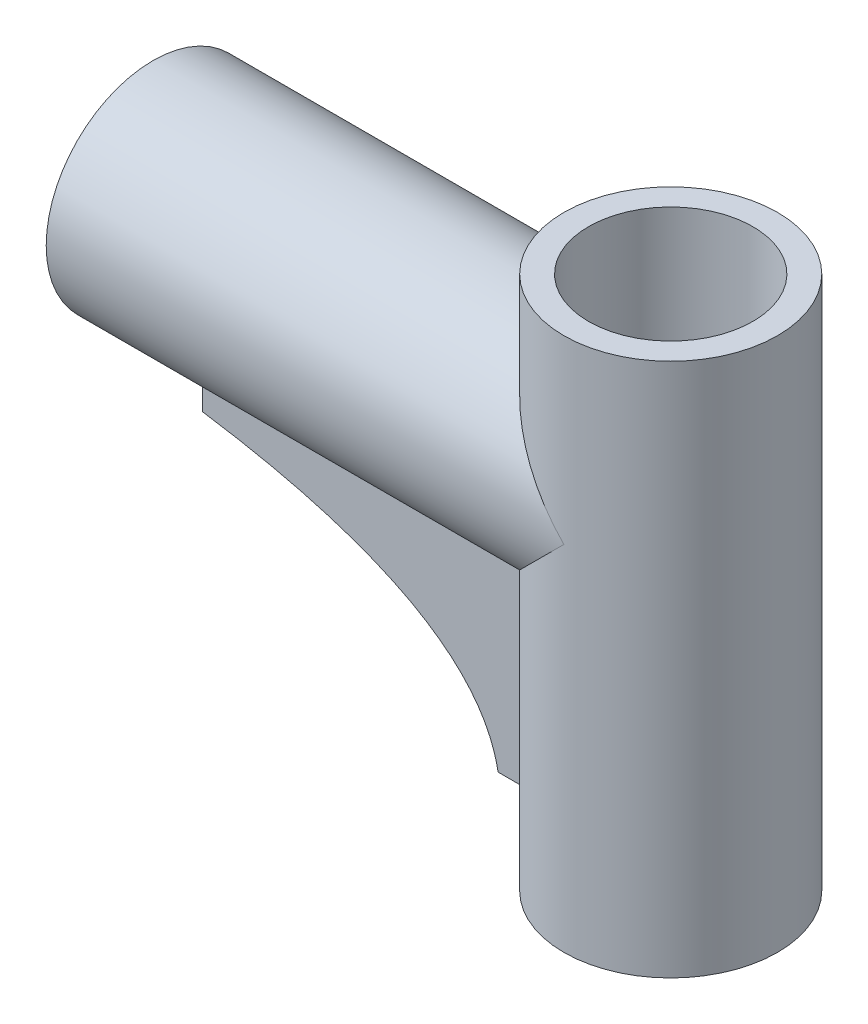
from build123d import *

# Parameters (mm, degrees)
BUITENCIRKEL_R                    = 13
CILINDER_BASIS_DEPTH              = 65
BINNENCIRKEL_MOTOR_R              = 11
HOLTE_MOTOR_DEPTH                 = 25
BINNENCIRKEL_BUIS_R               = 10
HOLTE_BUIS_DEPTH                  = 35
UITSPARING_MOTORAS_DEPTH          = 45.02272140611028
CIRKEL_MOTORPINNETJES_R           = 0.8999999999999995
UITSPARINGEN_MOTORPINNETJES_DEPTH = 2
CIRKEL_POLEN_R                    = 2.450000000000002
UITSPARINGEN_MOTORPOLEN_DEPTH     = 45.02272140611028
SKETCH2_R                         = 13.000000000000007
BOSS_EXTRUDE1_DEPTH               = 50
BOSS_EXTRUDE1_DIRECTION_2_REACH   = 73.204
SKETCH3_R                         = 10.000000000000005
CUT_EXTRUDE1_DEPTH                = 40
CUT_EXTRUDE2_REACH                = 79.421
CUT_EXTRUDE2_END_RADIUS           = 10
SKETCH4_R                         = 6.999999999999997
BOSS_EXTRUDE2_DEPTH               = 5
BOSS_EXTRUDE2_DEPTH_BACK          = 5
BOSS_EXTRUDE6_REACH               = 76.713
BOSS_EXTRUDE6_END_RADIUS          = 13.000000000000007
SKETCH11_W                        = 36.000000000000014
SKETCH11_H                        = 10
BOSS_EXTRUDE7_REACH               = 83.259
BOSS_EXTRUDE7_END_RADIUS          = 13.000000000000002
SKETCH12_W                        = 10
SKETCH12_H                        = 24.000000000000004


with BuildPart() as part:
    # Buitencirkel → Cilinder basis (new body)
    with BuildSketch(Plane(origin=(0, 0, 0), x_dir=(1, 0, 0), z_dir=(0, 1, 0))):
        Circle(BUITENCIRKEL_R)
    extrude(amount=CILINDER_BASIS_DEPTH)

    # Binnencirkel motor → Holte motor (cut)
    with BuildSketch(Plane(origin=(0, 0, 0), x_dir=(-1, 0, 0), z_dir=(0, -1, 0))):
        Circle(BINNENCIRKEL_MOTOR_R)
    extrude(amount=-HOLTE_MOTOR_DEPTH, mode=Mode.SUBTRACT)

    # Binnencirkel buis → Holte buis (cut)
    with BuildSketch(Plane(origin=(0, 65, 0), x_dir=(1, 0, 0), z_dir=(0, 1, 0))):
        Circle(BINNENCIRKEL_BUIS_R)
    extrude(amount=-HOLTE_BUIS_DEPTH, mode=Mode.SUBTRACT)

    # Cirkel motoras → Uitsparing motoras (cut, through all)
    with BuildSketch(Plane(origin=(0, 24.999999999999996, 0), x_dir=(-1, 0, 0), z_dir=(0, -1, 0))):
        with BuildLine():
            Line((2.3500000000000005, -1.6124515496597092), (2.3500000000000005, 1.6124515496597092))
            ThreePointArc((2.3500000000000005, 1.6124515496597092), (-2.85, 3.5e-16), (2.3500000000000005, -1.6124515496597092))
        make_face()
    extrude(amount=-UITSPARING_MOTORAS_DEPTH, mode=Mode.SUBTRACT)

    # Cirkel motorpinnetjes → Uitsparingen motorpinnetjes (add)
    with BuildSketch(Plane(origin=(0, 24.999999999999996, 0), x_dir=(-1, 0, 0), z_dir=(0, -1, 0))):
        with Locations((-5.5, 0)):
            Circle(CIRKEL_MOTORPINNETJES_R)
        with Locations((5.5, 0)):
            Circle(CIRKEL_MOTORPINNETJES_R)
    extrude(amount=UITSPARINGEN_MOTORPINNETJES_DEPTH)

    # Cirkel polen → Uitsparingen motorpolen (cut, through all)
    with BuildSketch(Plane(origin=(0, 24.999999999999996, 0), x_dir=(-1, 0, 0), z_dir=(0, -1, 0))):
        with Locations((9.2e-16, -7.55)):
            Circle(CIRKEL_POLEN_R)
        with Locations((9.2e-16, 7.55)):
            Circle(CIRKEL_POLEN_R)
    extrude(amount=-UITSPARINGEN_MOTORPOLEN_DEPTH, mode=Mode.SUBTRACT)

    # Sketch2 → Boss-Extrude1 (add)
    with BuildSketch(Plane.ZY.offset(13.000000000000002)):
        with Locations((0, 43)):
            Circle(SKETCH2_R)
    extrude(amount=BOSS_EXTRUDE1_DEPTH)

    # Boss-Extrude1 direction 2: up to this face of the body
    boss_extrude1_direction_2_end = part.part.faces().sort_by_distance((-13, 32.5, 0))[0]
    # Sketch2 → Boss-Extrude1 direction 2 (add, up to the picked face)
    with BuildSketch(Plane.ZY.offset(13.000000000000002), mode=Mode.PRIVATE) as boss_extrude1_direction_2_sk1:
        with Locations((0, 43)):
            Circle(SKETCH2_R)
    boss_extrude1_direction_2_tool1 = split(extrude(boss_extrude1_direction_2_sk1.sketch, amount=-BOSS_EXTRUDE1_DIRECTION_2_REACH, mode=Mode.PRIVATE), bisect_by=boss_extrude1_direction_2_end, keep=Keep.BOTH, mode=Mode.PRIVATE)
    add(boss_extrude1_direction_2_tool1.solids().sort_by(Axis((-13, 43, 0), (1, 0, 0)))[0])
    add(boss_extrude1_direction_2_tool1.solids().sort_by(Axis((-13, 43, 0), (1, 0, 0)))[1])

    # Sketch3 → Cut-Extrude1 (cut)
    with BuildSketch(Plane.ZY.offset(63)):
        with Locations((0, 43)):
            Circle(SKETCH3_R)
    extrude(amount=-CUT_EXTRUDE1_DEPTH, mode=Mode.SUBTRACT)

    # Cut-Extrude2: up to this cylinder (the profile starts outside it)
    cut_extrude2_end = Plane(origin=(0, 43, 0), z_dir=(0, 1, 0)) * Cylinder(CUT_EXTRUDE2_END_RADIUS, 179.842, mode=Mode.PRIVATE)
    # Sketch4 → Cut-Extrude2 (cut, up to the surface)
    with BuildSketch(Plane.ZY.offset(23), mode=Mode.PRIVATE) as cut_extrude2_sk1:
        with Locations((0, 43)):
            Circle(SKETCH4_R)
    cut_extrude2_tool1 = extrude(cut_extrude2_sk1.sketch, amount=-CUT_EXTRUDE2_REACH, mode=Mode.PRIVATE) - cut_extrude2_end
    add(cut_extrude2_tool1.solids().sort_by_distance((-23, 43, 0))[0], mode=Mode.SUBTRACT)



with BuildPart() as body_2:
    # Sketch5 → Boss-Extrude2 (new, two sides: drawn at the far end of the back side and taken through both)
    with BuildSketch(Plane.XY.offset(-BOSS_EXTRUDE2_DEPTH_BACK)):
        with BuildLine():
            Line((-52, 26.999999999999996), (-16, 27))
            Line((-16, 27), (-16, 6.999999999999999))
            add(Edge.make_bspline(
                [(-52, 26.999999999999996), (-18.780366723420578, 22.02228525010515), (-16, 6.999999999999999)],
                knots=[0, 0, 0, 1, 1, 1], degree=2))
        make_face()
    extrude(amount=BOSS_EXTRUDE2_DEPTH + BOSS_EXTRUDE2_DEPTH_BACK)


with BuildPart() as part_1:
    add(part.part)

    add(body_2.part)  # Boss-Extrude6 merges body 2
    # Boss-Extrude6: up to this cylinder (the profile starts outside it)
    boss_extrude6_end = Plane(origin=(-34, 43, 0), z_dir=(1, 0, 0)) * Cylinder(BOSS_EXTRUDE6_END_RADIUS, 180.426, mode=Mode.PRIVATE)
    # Sketch11 → Boss-Extrude6 (add, up to the surface)
    with BuildSketch(Plane(origin=(-2.6e-15, 27, 0), x_dir=(1, 1e-16, 0), z_dir=(-1e-16, 1, 0)), mode=Mode.PRIVATE) as boss_extrude6_sk1:
        with Locations((-34, 0)):
            Rectangle(SKETCH11_W, SKETCH11_H)
    boss_extrude6_tool1 = extrude(boss_extrude6_sk1.sketch, amount=BOSS_EXTRUDE6_REACH, mode=Mode.PRIVATE) - boss_extrude6_end
    add(boss_extrude6_tool1.solids().sort_by_distance((-34, 27, 0))[0])

    # Boss-Extrude7: up to this cylinder (the profile starts outside it)
    boss_extrude7_end = Plane(origin=(0, 19, 0), z_dir=(0, -1, 0)) * Cylinder(BOSS_EXTRUDE7_END_RADIUS, 193.518, mode=Mode.PRIVATE)
    # Sketch12 → Boss-Extrude7 (add, up to the surface)
    with BuildSketch(Plane(origin=(-15.999999999999996, -1.54e-15, 0), x_dir=(0, 0, -1), z_dir=(1, 1e-16, 0)), mode=Mode.PRIVATE) as boss_extrude7_sk1:
        with Locations((0, 19.000000000000004)):
            Rectangle(SKETCH12_W, SKETCH12_H)
    boss_extrude7_tool1 = extrude(boss_extrude7_sk1.sketch, amount=BOSS_EXTRUDE7_REACH, mode=Mode.PRIVATE) - boss_extrude7_end
    add(boss_extrude7_tool1.solids().sort_by_distance((-16, 19, 0))[0])


solid = part_1.part
